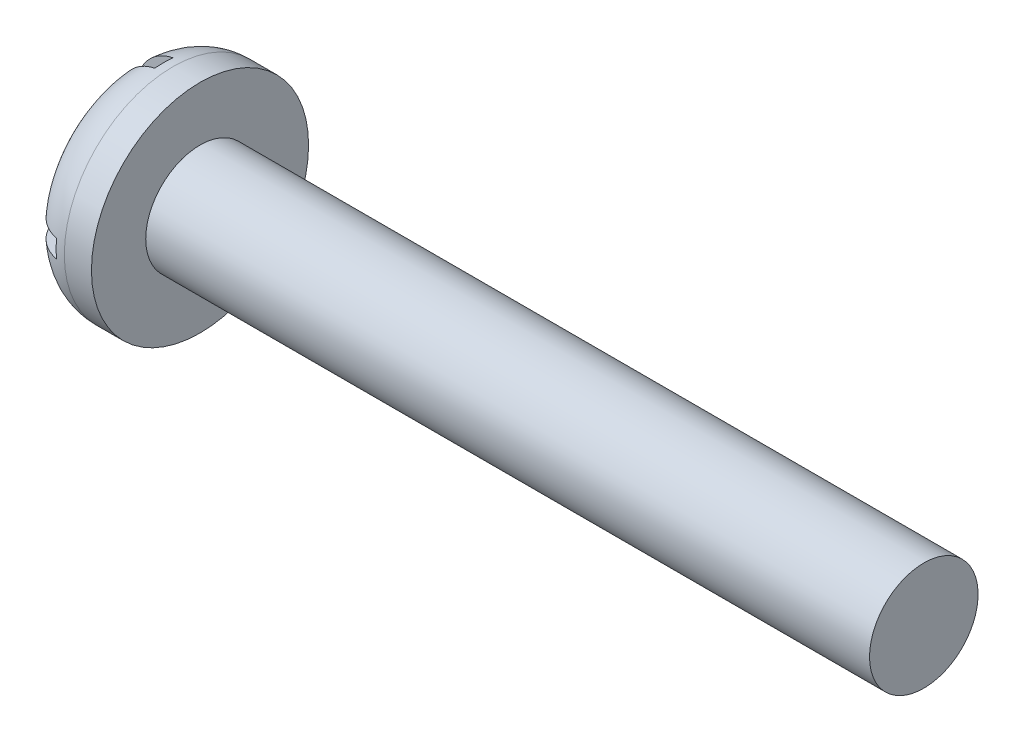
from build123d import *

# Parameters (mm, degrees)
CUT_EXTRUDE_1_DEPTH = 2


with BuildPart() as part:
    # Эскиз1 → Повернуть1 (revolve)
    with BuildSketch(Plane.XY, mode=Mode.PRIVATE) as revolve_1_sk:
        with BuildLine():
            Line((0, 0), (44, 0))
            Line((44, 0), (44, 3))
            Line((44, 3), (4, 3))
            Line((4, 3), (4, 6))
            Line((4, 6), (2.5, 6))
            ThreePointArc((2.5, 6), (0.732233047, 5.267766953), (0, 3.5))
            Line((0, 3.5), (0, 0))
        make_face()
    revolve(revolve_1_sk.sketch.rotate(Axis((-40.27641129, 0, 0), (1, 0, 0)), 90), axis=Axis((-40.27641129, 0, 0), (1, 0, 0)))

    # Эскиз2 → Вырез-Вытянуть1 (cut)
    with BuildSketch(Plane.ZY):
        Polygon((-0.5, -6.861954459), (0.5, -6.861954459), (0.5, -0.5), (7.705566097, -0.5), (7.705566097, 0.5), (0.5, 0.5), (0.5, 7.070683112), (-0.5, 7.070683112), (-0.5, 0.5), (-7.496837445, 0.5), (-7.496837445, -0.5), (-0.5, -0.5), align=None)
    extrude(amount=-CUT_EXTRUDE_1_DEPTH, mode=Mode.SUBTRACT)


solid = part.part
